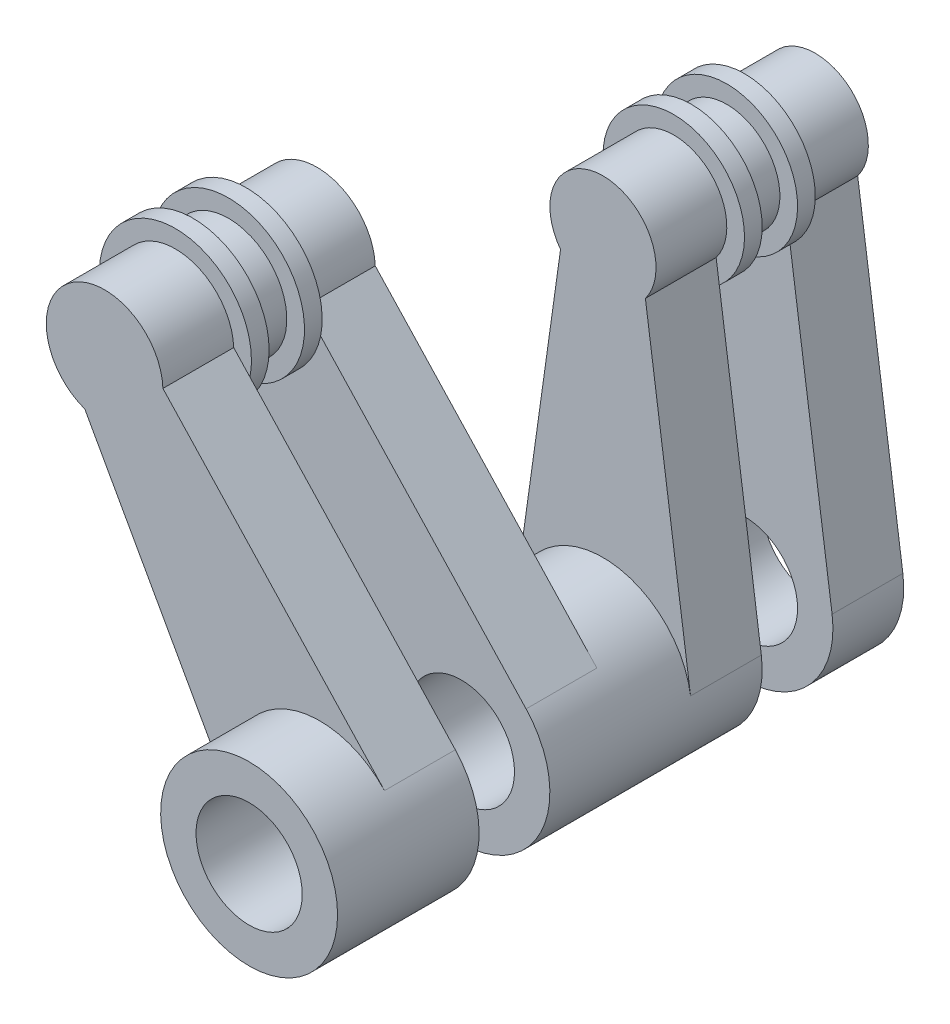
from build123d import *

# Parameters (mm, degrees)
ESBO_O1_R                = 1.5
RESSALTO_EXTRUS_O1_DEPTH = 2
ESBO_O2_R                = 1.5
RESSALTO_EXTRUS_O2_DEPTH = 1
ESBO_O4_R                = 2.5
ESBO_O4_R_2              = 1.5
RESSALTO_EXTRUS_O3_DEPTH = 2
ESBO_O5_R                = 1.5
RESSALTO_EXTRUS_O4_DEPTH = 2
ESBO_O6_R                = 1.648621548
RESSALTO_EXTRUS_O5_DEPTH = 1
ESBO_O7_W                = 11.938868243
ESBO_O7_H                = 15.738508052
CORTE_EXTRUS_O1_DEPTH    = 6
RESSALTO_EXTRUS_O6_START = -2
ESBO_O8_R                = 2.148621548
RESSALTO_EXTRUS_O6_DEPTH = 0.5
RESSALTO_EXTRUS_O7_START = -2.5
ESBO_O9_R                = 2.148621548
RESSALTO_EXTRUS_O7_DEPTH = 0.5
RESSALTO_EXTRUS_O8_START = -2.5
ESBO_O10_R               = 2
RESSALTO_EXTRUS_O8_DEPTH = 0.5
RESSALTO_EXTRUS_O9_START = -2
ESBO_O11_R               = 2
RESSALTO_EXTRUS_O9_DEPTH = 0.5


with BuildPart() as part:
    # Esboço1 → Ressalto-extrusão1 (new body)
    with BuildSketch(Plane.XY):
        with BuildLine():
            Line((-1.198777863, 9.438372785), (-2.475695902, 0.347749621))
            ThreePointArc((-2.475695902, 0.347749621), (-1.4263e-05, -2.5), (2.47569987, 0.347721373))
            Line((2.47569987, 0.347721373), (1.198866989, 9.438491296))
            ThreePointArc((1.198866989, 9.438491296), (-7.4142e-05, 11.839999998), (-1.198777863, 9.438372785))
        make_face()
        Circle(ESBO_O1_R, mode=Mode.SUBTRACT)
    extrude(amount=RESSALTO_EXTRUS_O1_DEPTH)

    # Esboço2 → Ressalto-extrusão2 (add)
    with BuildSketch(Plane.XY.offset(2)):
        with Locations(Location((0, 10.34, 0), (0, 0, 216.947631019))):
            Circle(ESBO_O2_R)
    extrude(amount=RESSALTO_EXTRUS_O2_DEPTH)

    # Espelhar1: part across plane


with BuildPart() as part_1:
    add(part.part)
    add(part.part.mirror(Plane(origin=(0, 10.34, 3), x_dir=(1, 0, 0), z_dir=(0, 0, 1))))

    # Esboço4 → Ressalto-extrusão3 (add)
    with BuildSketch(Plane.XY.offset(6)):
        with Locations(Location((0, 0, 0), (0, 0, 172.004238293))):
            Circle(ESBO_O4_R)
        Circle(ESBO_O4_R_2, mode=Mode.SUBTRACT)
    extrude(amount=RESSALTO_EXTRUS_O3_DEPTH)

    # Esboço5 → Ressalto-extrusão4 (add)
    with BuildSketch(Plane.XY.offset(8)):
        with BuildLine():
            Line((-6.643819561, 6.810437698), (-2.18535321, -1.21417929))
            ThreePointArc((-2.18535321, -1.21417929), (1.470887432, -2.021506904), (1.827663155, 1.705768857))
            Line((1.827663155, 1.705768857), (-4.435920088, 8.416947961))
            ThreePointArc((-4.435920088, 8.416947961), (-7.053565106, 9.69403249), (-6.643819561, 6.810437698))
        make_face()
        Circle(ESBO_O5_R, mode=Mode.SUBTRACT)
    extrude(amount=RESSALTO_EXTRUS_O4_DEPTH)

    # Esboço6 → Ressalto-extrusão5 (add)
    with BuildSketch(Plane.XY.offset(10)):
        with Locations(Location((-6.08359042, 8.360952554, 0), (0, 0, 250.134292883))):
            Circle(ESBO_O6_R)
    extrude(amount=RESSALTO_EXTRUS_O5_DEPTH)

    # Espelhar3: part across plane


with BuildPart() as part_2:
    add(part_1.part)
    add(part_1.part.mirror(Plane(origin=(-6.08359042, 8.360952554, 11), x_dir=(1, 0, 0), z_dir=(0, 0, 1))))

    # Esboço7 → Corte-extrusão1 (cut)
    with BuildSketch(Plane.XY.offset(22)):
        with Locations((-0.266328734, 4.470018957)):
            Rectangle(ESBO_O7_W, ESBO_O7_H)
    extrude(amount=-CORTE_EXTRUS_O1_DEPTH, mode=Mode.SUBTRACT)

    # Esboço8 → Ressalto-extrusão6 (add)
    with BuildSketch(Plane.XY.offset(14).offset(RESSALTO_EXTRUS_O6_START)):
        with Locations((-6.08359042, 8.360952554)):
            Circle(ESBO_O8_R)
    extrude(amount=-RESSALTO_EXTRUS_O6_DEPTH)

    # Esboço9 → Ressalto-extrusão7 (add)
    with BuildSketch(Plane(origin=(0, 0, 8), x_dir=(-1, 0, 0), z_dir=(0, 0, -1)).offset(RESSALTO_EXTRUS_O7_START)):
        with Locations(Location((6.08359042, 8.360952554, 0), (0, 0, 180))):
            Circle(ESBO_O9_R)
    extrude(amount=RESSALTO_EXTRUS_O7_DEPTH)

    # Esboço10 → Ressalto-extrusão8 (add)
    with BuildSketch(Plane(origin=(0, 0, 0), x_dir=(-1, 0, 0), z_dir=(0, 0, -1)).offset(RESSALTO_EXTRUS_O8_START)):
        with Locations(Location((0, 10.34, 0), (0, 0, 229.937782743))):
            Circle(ESBO_O10_R)
    extrude(amount=RESSALTO_EXTRUS_O8_DEPTH)

    # Esboço11 → Ressalto-extrusão9 (add)
    with BuildSketch(Plane.XY.offset(6).offset(RESSALTO_EXTRUS_O9_START)):
        with Locations(Location((0, 10.34, 0), (0, 0, 229.941078536))):
            Circle(ESBO_O11_R)
    extrude(amount=-RESSALTO_EXTRUS_O9_DEPTH)


solid = part_2.part
